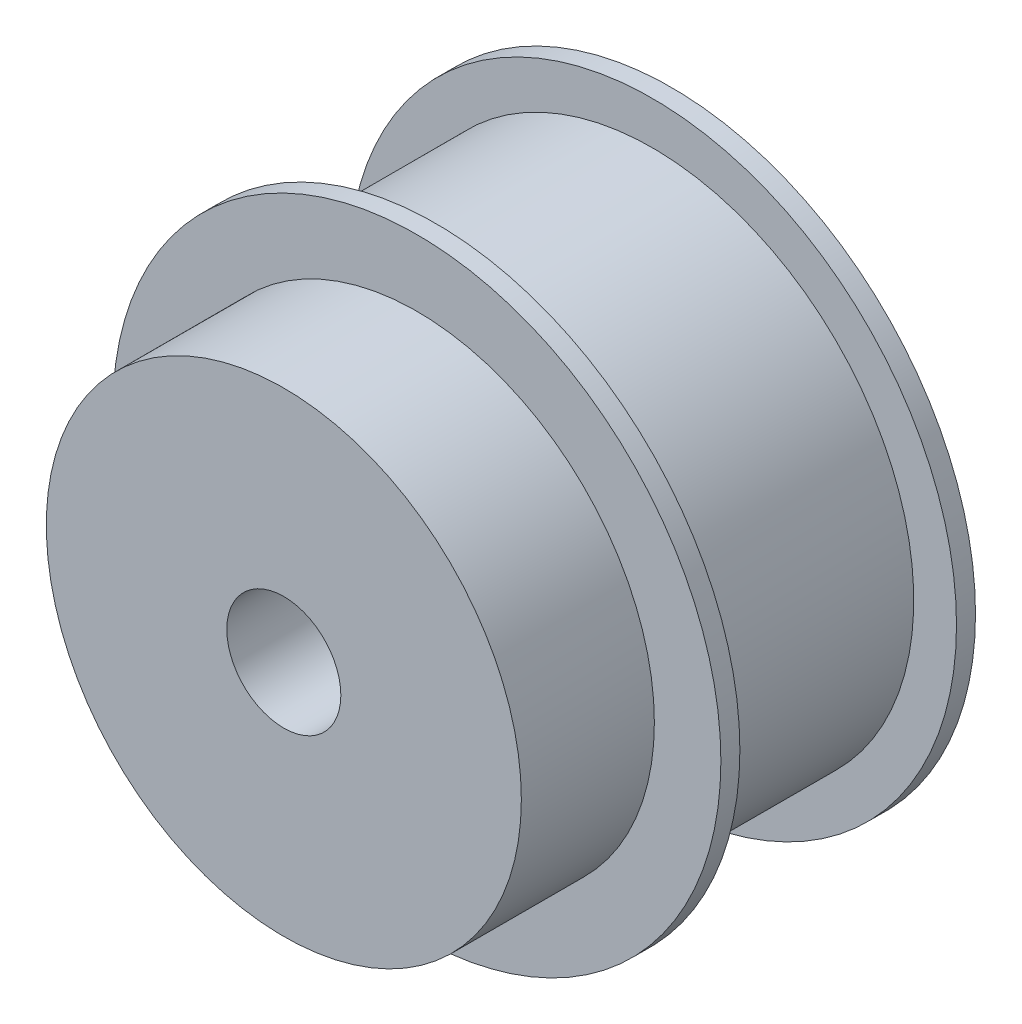
from build123d import *

# Parameters (mm, degrees)
ESQUISSE1_R             = 13.75
BOSS_EXTRU_1_DEPTH      = 11.4
ESQUISSE2_R             = 16
BOSS_EXTRU_2_DEPTH      = 1
BOSS_EXTRU_3_START      = 1
ESQUISSE3_R             = 16
BOSS_EXTRU_3_DEPTH      = 1
ESQUISSE4_R             = 12.5
BOSS_EXTRU_4_DEPTH      = 7
ESQUISSE5_R             = 3
ENL_V_MAT_EXTRU_1_DEPTH = 30


with BuildPart() as part:
    # Esquisse1 → Boss.-Extru.1 (new body)
    with BuildSketch(Plane.XY):
        Circle(ESQUISSE1_R)
    extrude(amount=BOSS_EXTRU_1_DEPTH)

    # Esquisse2 → Boss.-Extru.2 (add)
    with BuildSketch(Plane.XY.offset(11.4)):
        Circle(ESQUISSE2_R)
    extrude(amount=BOSS_EXTRU_2_DEPTH)

    # Esquisse3 → Boss.-Extru.3 (add)
    with BuildSketch(Plane(origin=(0, 0, 0), x_dir=(-1, 0, 0), z_dir=(0, 0, -1)).offset(BOSS_EXTRU_3_START)):
        with Locations(Location((0, 0, 0), (0, 0, 180))):
            Circle(ESQUISSE3_R)
    extrude(amount=-BOSS_EXTRU_3_DEPTH)

    # Esquisse4 → Boss.-Extru.4 (add)
    with BuildSketch(Plane.XY.offset(12.4)):
        Circle(ESQUISSE4_R)
    extrude(amount=BOSS_EXTRU_4_DEPTH)

    # Esquisse5 → Enlèv. mat.-Extru.1 (cut)
    with BuildSketch(Plane(origin=(0, 0, -1), x_dir=(-1, 0, 0), z_dir=(0, 0, -1))):
        Circle(ESQUISSE5_R)
    extrude(amount=-ENL_V_MAT_EXTRU_1_DEPTH, mode=Mode.SUBTRACT)


solid = part.part
